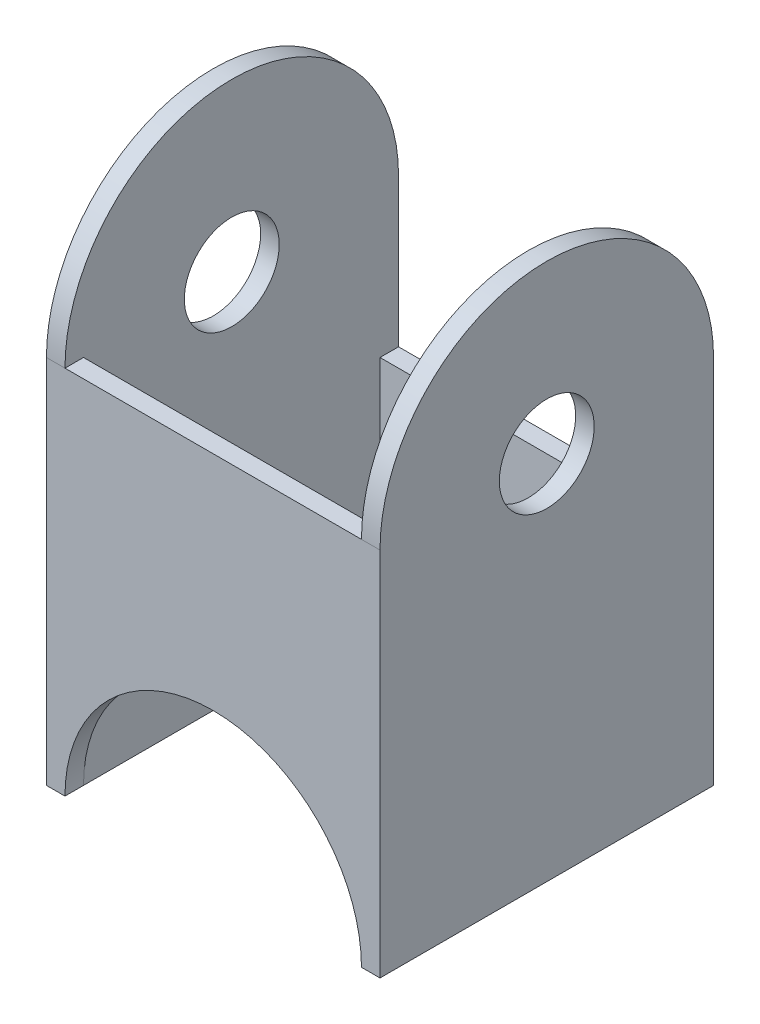
from build123d import *

# Parameters (mm, degrees)
SKETCH1_W               = 28.575
SKETCH1_H               = 28.575
SKETCH1_W_2             = 25.4
SKETCH1_H_2             = 25.4
BOSS_EXTRUDE1_DEPTH     = 31.75
SKETCH2_R               = 14.2875
BOSS_EXTRUDE2_DEPTH     = 1.5875
BOSS_EXTRUDE3_START     = -1.5875
SKETCH3_R               = 14.2875
BOSS_EXTRUDE3_DEPTH     = 1.5875
CUT_EXTRUDE1_DEPTH      = 57.036726238
CUT_EXTRUDE1_DEPTH_BACK = 57.036726238
SKETCH4_R               = 4.064
CUT_EXTRUDE2_DEPTH      = 57.036726238
CUT_EXTRUDE2_DEPTH_BACK = 57.036726238
SKETCH5_R               = 12.7
CUT_EXTRUDE3_REACH      = 57.244
SKETCH6_W               = 25.4
SKETCH6_H               = 12.7


with BuildPart() as part:
    # Sketch1 → Boss-Extrude1 (new body)
    with BuildSketch(Plane(origin=(0, 0, 0), x_dir=(1, 0, 0), z_dir=(0, 1, 0))):
        Rectangle(SKETCH1_W, SKETCH1_H)
        Rectangle(SKETCH1_W_2, SKETCH1_H_2, mode=Mode.SUBTRACT)
    extrude(amount=BOSS_EXTRUDE1_DEPTH)

    # Sketch2 → Boss-Extrude2 (add)
    with BuildSketch(Plane.ZY.offset(14.2875)):
        with Locations((0, 31.75)):
            Circle(SKETCH2_R)
    extrude(amount=-BOSS_EXTRUDE2_DEPTH)

    # Sketch3 → Boss-Extrude3 (add)
    with BuildSketch(Plane(origin=(14.2875, 0, 0), x_dir=(0, 0, -1), z_dir=(1, 0, 0)).offset(BOSS_EXTRUDE3_START)):
        with Locations((0, 31.75)):
            Circle(SKETCH3_R)
    extrude(amount=BOSS_EXTRUDE3_DEPTH)

    # Sketch4 → Cut-Extrude1 (cut, two sides: drawn at the far end of the back side and taken through both)
    with BuildSketch(Plane.ZY.offset(14.2875).offset(-CUT_EXTRUDE1_DEPTH_BACK)):
        with Locations(Location((0, 31.75, 0), (0, 0, 180))):
            Circle(SKETCH4_R)
    extrude(amount=CUT_EXTRUDE1_DEPTH + CUT_EXTRUDE1_DEPTH_BACK, mode=Mode.SUBTRACT)

    # Sketch5 → Cut-Extrude2 (cut, two sides: drawn at the far end of the back side and taken through both)
    with BuildSketch(Plane.XY.offset(14.2875).offset(-CUT_EXTRUDE2_DEPTH_BACK)):
        Circle(SKETCH5_R)
    extrude(amount=CUT_EXTRUDE2_DEPTH + CUT_EXTRUDE2_DEPTH_BACK, mode=Mode.SUBTRACT)

    # Sketch6 → Cut-Extrude3 (cut, up to next)
    with BuildSketch(Plane.XY.offset(-12.7), mode=Mode.PRIVATE) as cut_extrude3_sk1:
        with Locations((0, 25.4)):
            Rectangle(SKETCH6_W, SKETCH6_H)
    cut_extrude3_tool1 = extrude(cut_extrude3_sk1.sketch, amount=-CUT_EXTRUDE3_REACH, mode=Mode.PRIVATE) & part.part
    add(cut_extrude3_tool1.solids().sort_by_distance((0, 25.4, -12.7))[0], mode=Mode.SUBTRACT)


solid = part.part
